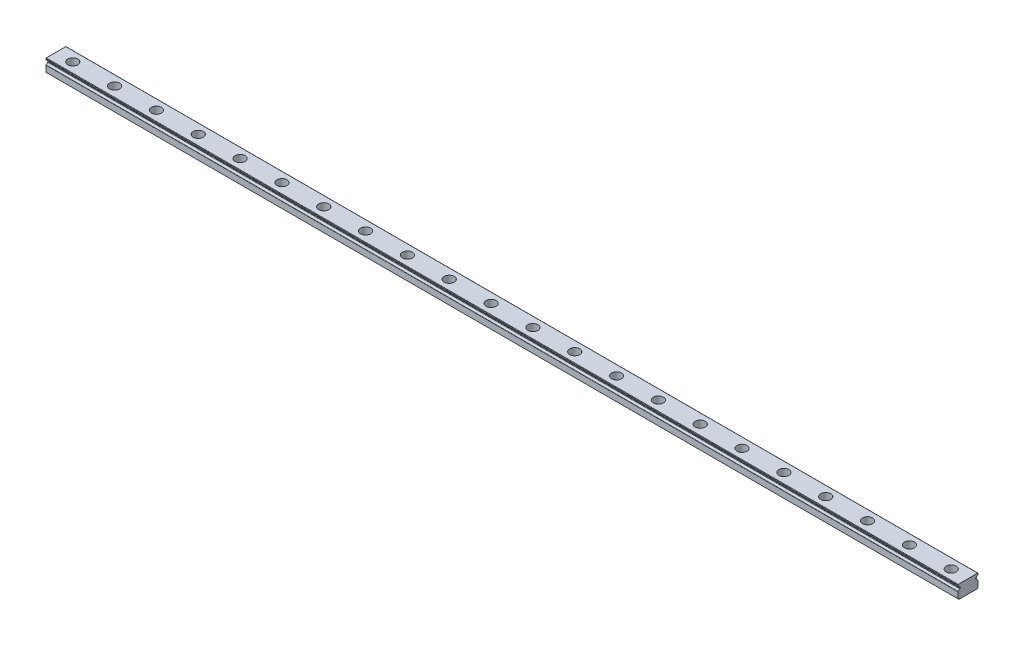
from build123d import *

# Parameters (mm, degrees)
SKETCH_1_W                   = 545
SKETCH_1_H                   = 12
EXTRUDE_1_DEPTH              = 8
CUT_EXTRUDE_1_DEPTH          = 546.047704334
CUT_EXTRUDE_2_DEPTH          = 546.047704334
CUT_EXTRUDE_3_DEPTH          = 546.047704334
CUT_EXTRUDE_4_DEPTH          = 546.047704334
CUT_EXTRUDE_5_DEPTH          = 546.047704334
CUT_EXTRUDE_6_DEPTH          = 546.047704334
HOLE_WIZARD_M3_1_D           = 3.5
HOLE_WIZARD_M3_1_CBORE_D     = 5.9999
HOLE_WIZARD_M3_1_CBORE_DEPTH = 4.5
CHAMFER_1_SIZE               = 0.6
FILLET_1_R                   = 0.2


with BuildPart() as part:
    # 草图1 → 凸台-拉伸1 (new body)
    with BuildSketch(Plane(origin=(0, 4, 0), x_dir=(1, 0, 0), z_dir=(0, 1, 0))):
        Rectangle(SKETCH_1_W, SKETCH_1_H)
    extrude(amount=-EXTRUDE_1_DEPTH)

    # 草图2 → 切除-拉伸1 (cut, through all)
    with BuildSketch(Plane(origin=(272.5, 0, 0), x_dir=(0, 0, -1), z_dir=(1, 0, 0))):
        with BuildLine():
            Line((6, 1.51), (6, 2.01))
            Line((6, 2.01), (4.8, 2.01))
            ThreePointArc((4.8, 2.01), (4.55, 1.76), (4.8, 1.51))
            Line((4.8, 1.51), (6, 1.51))
        make_face()
    extrude(amount=-CUT_EXTRUDE_1_DEPTH, mode=Mode.SUBTRACT)

    # 草图3 → 切除-拉伸2 (cut, through all)
    with BuildSketch(Plane(origin=(272.5, 0, 0), x_dir=(0, 0, -1), z_dir=(1, 0, 0))):
        with BuildLine():
            Line((6, 2.01), (6, 3.111111))
            ThreePointArc((6, 3.111111), (5.367595703, 2.693428684), (5.04, 2.01))
            Line((5.04, 2.01), (6, 2.01))
        make_face()
    extrude(amount=-CUT_EXTRUDE_2_DEPTH, mode=Mode.SUBTRACT)

    # 草图4 → 切除-拉伸3 (cut, through all)
    with BuildSketch(Plane(origin=(272.5, 0, 0), x_dir=(0, 0, -1), z_dir=(1, 0, 0))):
        with BuildLine():
            Line((6, 1.51), (5.04, 1.51))
            ThreePointArc((5.04, 1.51), (5.367595703, 0.826571316), (6, 0.408889))
            Line((6, 0.408889), (6, 1.51))
        make_face()
    extrude(amount=-CUT_EXTRUDE_3_DEPTH, mode=Mode.SUBTRACT)

    # 草图5 → 切除-拉伸4 (cut, through all)
    with BuildSketch(Plane(origin=(272.5, 0, 0), x_dir=(0, 0, -1), z_dir=(1, 0, 0))):
        with BuildLine():
            Line((-6, 2.01), (-6, 1.51))
            Line((-6, 1.51), (-4.8, 1.51))
            ThreePointArc((-4.8, 1.51), (-4.55, 1.76), (-4.8, 2.01))
            Line((-4.8, 2.01), (-6, 2.01))
        make_face()
    extrude(amount=-CUT_EXTRUDE_4_DEPTH, mode=Mode.SUBTRACT)

    # 草图6 → 切除-拉伸5 (cut, through all)
    with BuildSketch(Plane(origin=(272.5, 0, 0), x_dir=(0, 0, -1), z_dir=(1, 0, 0))):
        with BuildLine():
            Line((-6, 1.51), (-6, 0.408889))
            ThreePointArc((-6, 0.408889), (-5.367595703, 0.826571316), (-5.04, 1.51))
            Line((-5.04, 1.51), (-6, 1.51))
        make_face()
    extrude(amount=-CUT_EXTRUDE_5_DEPTH, mode=Mode.SUBTRACT)

    # 草图7 → 切除-拉伸6 (cut, through all)
    with BuildSketch(Plane(origin=(272.5, 0, 0), x_dir=(0, 0, -1), z_dir=(1, 0, 0))):
        with BuildLine():
            Line((-6, 2.01), (-5.04, 2.01))
            ThreePointArc((-5.04, 2.01), (-5.367595703, 2.693428684), (-6, 3.111111))
            Line((-6, 3.111111), (-6, 2.01))
        make_face()
    extrude(amount=-CUT_EXTRUDE_6_DEPTH, mode=Mode.SUBTRACT)

    # M3 六角头机械螺钉的柱形沉头孔1 (through all)
    with Locations(Plane(origin=(0, 4, 0), x_dir=(1, 0, 0), z_dir=(0, 1, 0))):
        with Locations((-262.5, 0), (-237.5, 0), (-212.5, 0), (-187.5, 0), (-162.5, 0), (-137.5, 0), (-112.5, 0), (-87.5, 0), (-62.5, 0), (-37.5, 0), (-12.5, 0), (12.5, 0), (37.5, 0), (62.5, 0), (87.5, 0), (112.5, 0), (137.5, 0), (162.5, 0), (187.5, 0), (212.5, 0), (237.5, 0), (262.5, 0)):
            CounterBoreHole(HOLE_WIZARD_M3_1_D / 2, HOLE_WIZARD_M3_1_CBORE_D / 2, HOLE_WIZARD_M3_1_CBORE_DEPTH)

    # 倒角1
    chamfer_1_edges = [part.edges().sort_by_distance(p)[0] for p in [
        (0, -4, -6),
        (0, -4, 6),
    ]]
    chamfer(chamfer_1_edges, length=CHAMFER_1_SIZE)

    # 圆角1
    fillet_1_edges = [part.edges().sort_by_distance(p)[0] for p in [
        (0, 2.01, -5.04),
        (0, 3.111111, -6),
        (0, 0.408889, -6),
        (0, 1.51, -5.04),
        (0, 4, -6),
        (0, 4, 6),
        (0, 1.51, 5.04),
        (0, 0.408889, 6),
        (0, 3.111111, 6),
        (0, 2.01, 5.04),
    ]]
    fillet(fillet_1_edges, radius=FILLET_1_R)


solid = part.part
